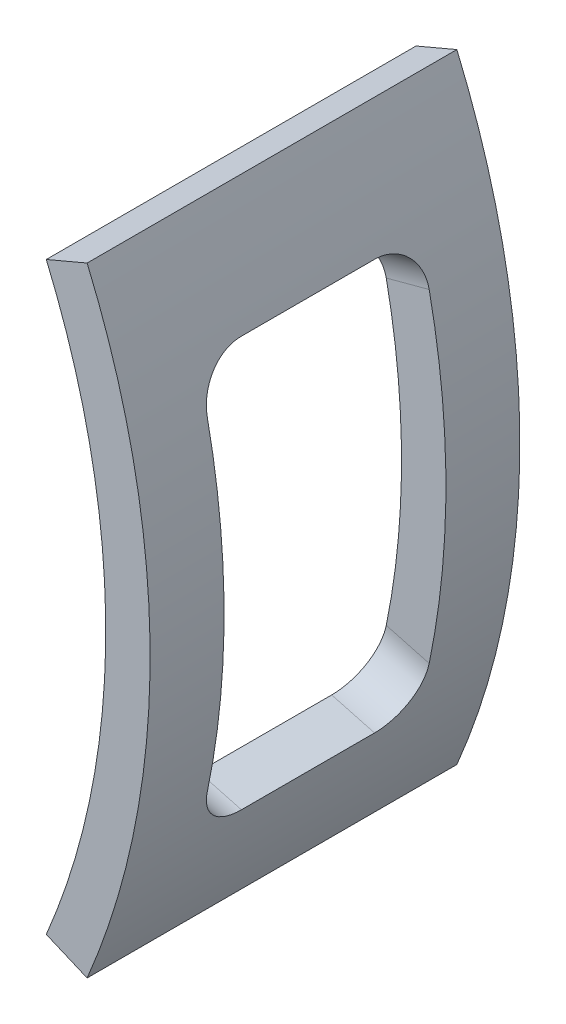
from build123d import *

# Parameters (mm, degrees)
SKETCH3_W                    = 6
SKETCH3_H                    = 50
REVOLVE1_ANGLE               = 23
REVOLVE1_OTHER_WAY_ANGLE     = 23
SKETCH4_W                    = 6
SKETCH4_H                    = 30
CUT_REVOLVE1_ANGLE           = 15
CUT_REVOLVE1_OTHER_WAY_ANGLE = 15
FILLET1_R                    = 6


with BuildPart() as part:
    # Sketch3 → Revolve1 (revolve)
    with BuildSketch(Plane(origin=(0, 0, 0), x_dir=(1, 0, 0), z_dir=(0, 1, 0))):
        with Locations((104.15, 0)):
            Rectangle(SKETCH3_W, SKETCH3_H)
    revolve(axis=Axis((0, 0, 17.71875), (0, 0, -1)), revolution_arc=REVOLVE1_ANGLE)

    # Sketch3 → Revolve1 other way (revolve)
    with BuildSketch(Plane(origin=(0, 0, 0), x_dir=(1, 0, 0), z_dir=(0, 1, 0))):
        with Locations((104.15, 0)):
            Rectangle(SKETCH3_W, SKETCH3_H)
    revolve(axis=Axis((0, 0, 17.71875), (0, 0, 1)), revolution_arc=REVOLVE1_OTHER_WAY_ANGLE)

    # Sketch4 → Cut-Revolve1 (revolve, cut)
    with BuildSketch(Plane(origin=(0, 0, 0), x_dir=(1, 0, 0), z_dir=(0, 1, 0))):
        with Locations((104.15, 0)):
            Rectangle(SKETCH4_W, SKETCH4_H)
    revolve(axis=Axis((0, 0, 15), (0, 0, -1)), revolution_arc=CUT_REVOLVE1_ANGLE, mode=Mode.SUBTRACT)

    # Sketch4 → Cut-Revolve1 other way (revolve, cut)
    with BuildSketch(Plane(origin=(0, 0, 0), x_dir=(1, 0, 0), z_dir=(0, 1, 0))):
        with Locations((104.15, 0)):
            Rectangle(SKETCH4_W, SKETCH4_H)
    revolve(axis=Axis((0, 0, 15), (0, 0, 1)), revolution_arc=CUT_REVOLVE1_OTHER_WAY_ANGLE, mode=Mode.SUBTRACT)

    # Fillet1
    fillet1_edges = [part.edges().sort_by_distance(p)[0] for p in [
        (100.601174808, -26.956003547, 15),
        (100.601174808, -26.956003547, -15),
        (100.601174808, 26.956003547, 15),
        (100.601174808, 26.956003547, -15),
    ]]
    fillet(fillet1_edges, radius=FILLET1_R)


solid = part.part
